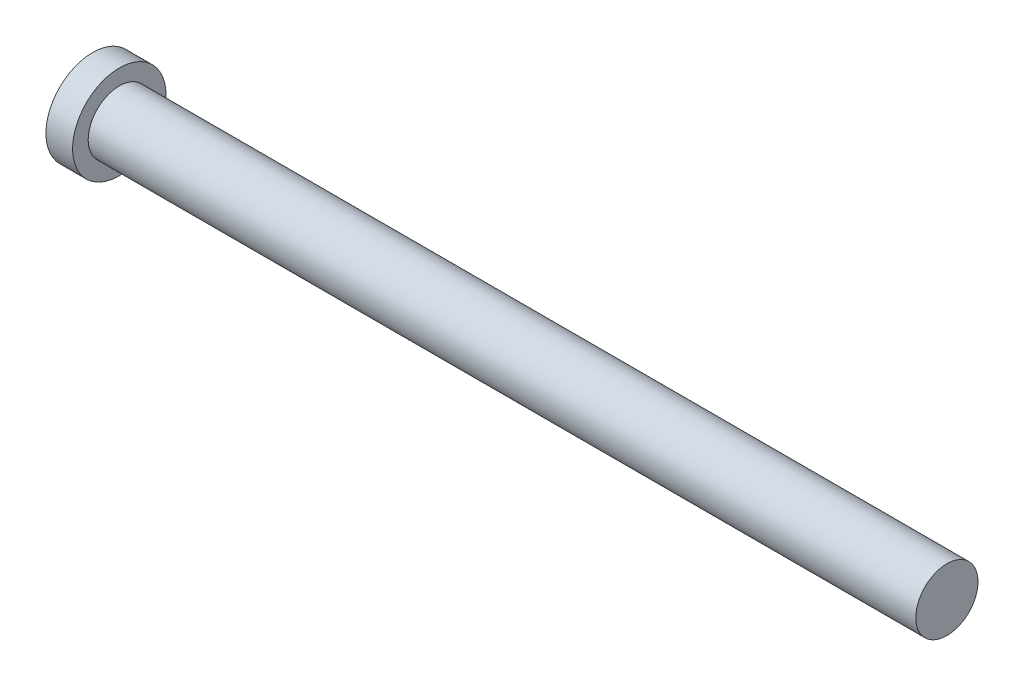
from build123d import *

# Parameters (mm, degrees)
SKETCH1_R           = 5.25
BOSS_EXTRUDE1_DEPTH = 3
SKETCH2_R           = 3.5
BOSS_EXTRUDE2_DEPTH = 93


with BuildPart() as part:
    # Sketch1 → Boss-Extrude1 (new body)
    with BuildSketch(Plane(origin=(0, 0, 0), x_dir=(0, 0, -1), z_dir=(1, 0, 0))):
        Circle(SKETCH1_R)
    extrude(amount=BOSS_EXTRUDE1_DEPTH)

    # Sketch2 → Boss-Extrude2 (add)
    with BuildSketch(Plane(origin=(3, 0, 0), x_dir=(0, 0, -1), z_dir=(1, 0, 0))):
        with Locations(Location((0, 0, 0), (0, 0, 180))):
            Circle(SKETCH2_R)
    extrude(amount=BOSS_EXTRUDE2_DEPTH)


solid = part.part
